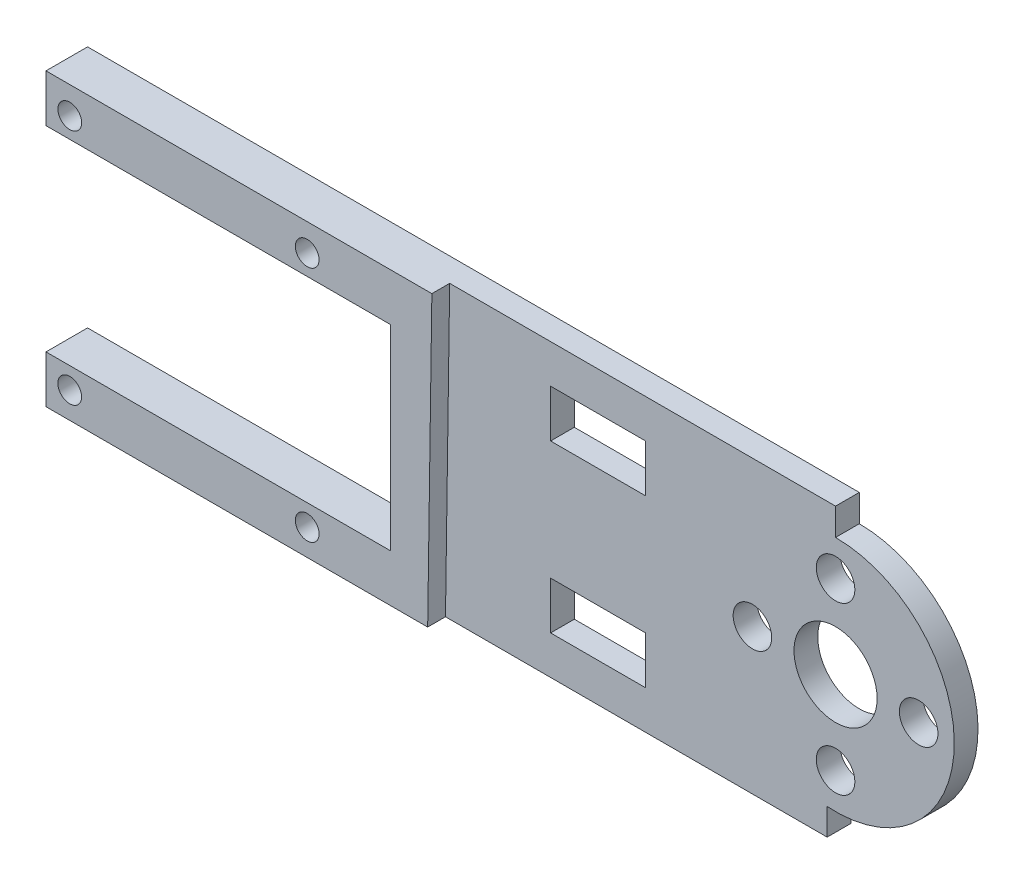
from build123d import *

# Parameters (mm, degrees)
SKETCH1_R           = 1.625
SKETCH1_R_2         = 3.5
SKETCH1_R_3         = 1.125
SKETCH1_W           = 8
SKETCH1_H           = 4
BOSS_EXTRUDE1_DEPTH = 2
BOSS_EXTRUDE2_DEPTH = 1.5
SKETCH4_R           = 1
CUT_EXTRUDE1_DEPTH  = 52.758903682


with BuildPart() as part:
    # Sketch1 → Boss-Extrude1 (new body)
    with BuildSketch(Plane.XY):
        with BuildLine():
            Line((-4.833560916, 12.25), (5.166439084, 12.25))
            Line((5.166439084, 12.25), (40.166439084, 12.25))
            Line((40.166439084, 12.25), (40.166439084, 9.964216866))
            ThreePointArc((40.166439084, 9.964216866), (50.16018383, -0.389429797), (39.459588189, -10.010769942))
            Line((39.459588189, -10.010769942), (39.459588189, -12.25))
            Line((39.459588189, -12.25), (5.166439084, -12.25))
            Line((5.166439084, -12.25), (-4.833560916, -12.25))
            Line((-4.833560916, -12.25), (-24.833560916, -12.25))
            Line((-24.833560916, -12.25), (-24.833560916, -8.25))
            Line((-24.833560916, -8.25), (4.166439084, -8.25))
            Line((4.166439084, -8.25), (4.166439084, 8.25))
            Line((4.166439084, 8.25), (-24.833560916, 8.25))
            Line((-24.833560916, 8.25), (-24.833560916, 12.25))
            Line((-24.833560916, 12.25), (-4.833560916, 12.25))
        make_face()
        with Locations((40.166439084, 6.964216866)):
            Circle(SKETCH1_R, mode=Mode.SUBTRACT)
        with Locations((47.166439084, -0.035783134)):
            Circle(SKETCH1_R, mode=Mode.SUBTRACT)
        with Locations((40.166439084, -7.035783134)):
            Circle(SKETCH1_R, mode=Mode.SUBTRACT)
        with Locations((33.166439084, -0.035783134)):
            Circle(SKETCH1_R, mode=Mode.SUBTRACT)
        with Locations((40.166439084, -0.035783134)):
            Circle(SKETCH1_R_2, mode=Mode.SUBTRACT)
        with Locations((-2.833560916, 9.964216866)):
            Circle(SKETCH1_R_3, mode=Mode.SUBTRACT)
        with Locations((-2.833560916, -10.035783134)):
            Circle(SKETCH1_R_3, mode=Mode.SUBTRACT)
        with Locations((-22.833560916, 9.964216866)):
            Circle(SKETCH1_R_3, mode=Mode.SUBTRACT)
        with Locations((-22.833560916, -10.035783134)):
            Circle(SKETCH1_R_3, mode=Mode.SUBTRACT)
        with Locations((20.166471095, 7)):
            Rectangle(SKETCH1_W, SKETCH1_H, mode=Mode.SUBTRACT)
        with Locations((20.166471095, -7)):
            Rectangle(SKETCH1_W, SKETCH1_H, mode=Mode.SUBTRACT)
    extrude(amount=BOSS_EXTRUDE1_DEPTH)

    # Sketch2 → Boss-Extrude2 (add)
    with BuildSketch(Plane.XY.offset(2)):
        Polygon((-24.833560916, 12.25), (7.666439084, 12.25), (7.313013637, -12.25), (-24.833560916, -12.25), (-24.833560916, -8.25), (4.166439084, -8.25), (4.166439084, 8.25), (-24.833560916, 8.25), align=None)
    extrude(amount=BOSS_EXTRUDE2_DEPTH)

    # Sketch4 → Cut-Extrude1 (cut, through all)
    with BuildSketch(Plane(origin=(0, 0, 0), x_dir=(-1, 0, 0), z_dir=(0, 0, -1))):
        with Locations((2.833560916, 9.964216866)):
            Circle(SKETCH4_R)
        with Locations((2.833560916, -10.035783134)):
            Circle(SKETCH4_R)
        with Locations((22.833560916, -10.035783134)):
            Circle(SKETCH4_R)
        with Locations((22.833560916, 9.964216866)):
            Circle(SKETCH4_R)
    extrude(amount=-CUT_EXTRUDE1_DEPTH, mode=Mode.SUBTRACT)


solid = part.part
